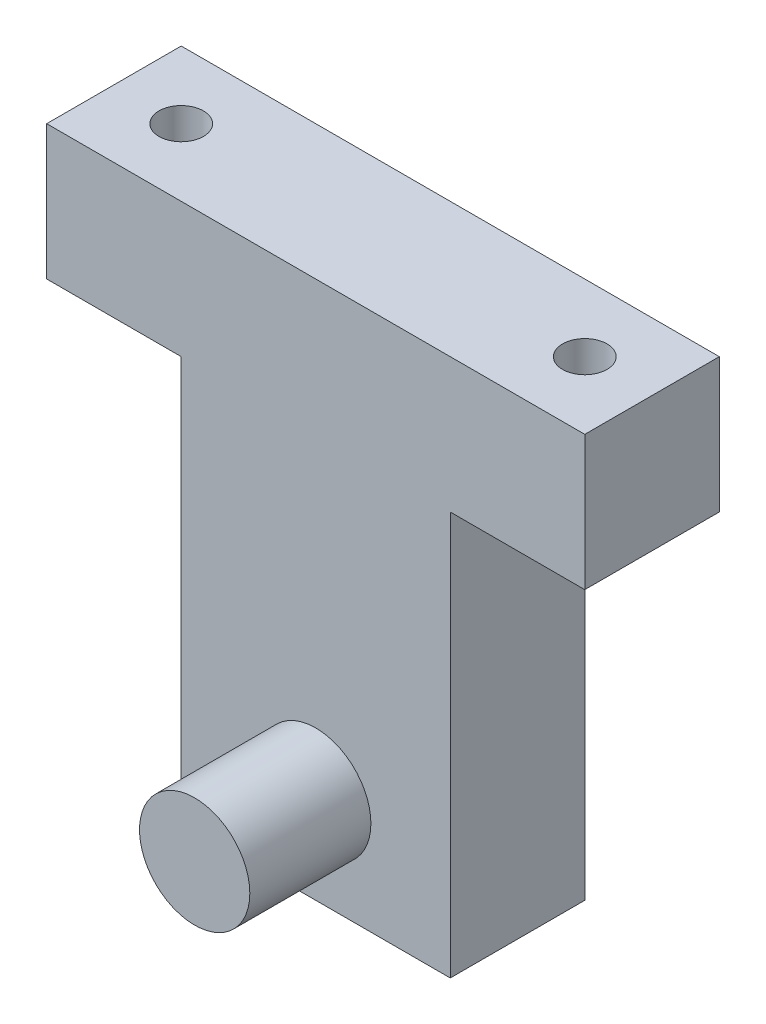
from build123d import *

# Parameters (mm, degrees)
SKETCH_1_W          = 10
SKETCH_1_H          = 10
SKETCH_1_W_2        = 20
SKETCH_1_H_2        = 40
EXTRUDE_5_DEPTH     = 10
SKETCH_7_R          = 4.1
EXTRUDE_6_DEPTH     = 9
SKETCH_8_R          = 1.65
CUT_EXTRUDE_1_DEPTH = 10


with BuildPart() as part:
    # Эскиз1 → Бобышка-Вытянуть5 (new body)
    with BuildSketch(Plane.XY):
        with Locations((-15, 15)):
            Rectangle(SKETCH_1_W, SKETCH_1_H)
        Rectangle(SKETCH_1_W_2, SKETCH_1_H_2)
        with Locations((15, 15)):
            Rectangle(SKETCH_1_W, SKETCH_1_H)
    extrude(amount=EXTRUDE_5_DEPTH)

    # Эскиз7 → Бобышка-Вытянуть6 (add)
    with BuildSketch(Plane.XY.offset(10)):
        with Locations((0, -13)):
            Circle(SKETCH_7_R)
    extrude(amount=EXTRUDE_6_DEPTH)

    # Эскиз8 → Вырез-Вытянуть1 (cut)
    with BuildSketch(Plane(origin=(0, 20, 0), x_dir=(1, 0, 0), z_dir=(0, 1, 0))):
        with Locations(Location((-15, -5, 0), (0, 0, 270))):
            Circle(SKETCH_8_R)
        with Locations(Location((15, -5, 0), (0, 0, 90))):
            Circle(SKETCH_8_R)
    extrude(amount=-CUT_EXTRUDE_1_DEPTH, mode=Mode.SUBTRACT)


solid = part.part
